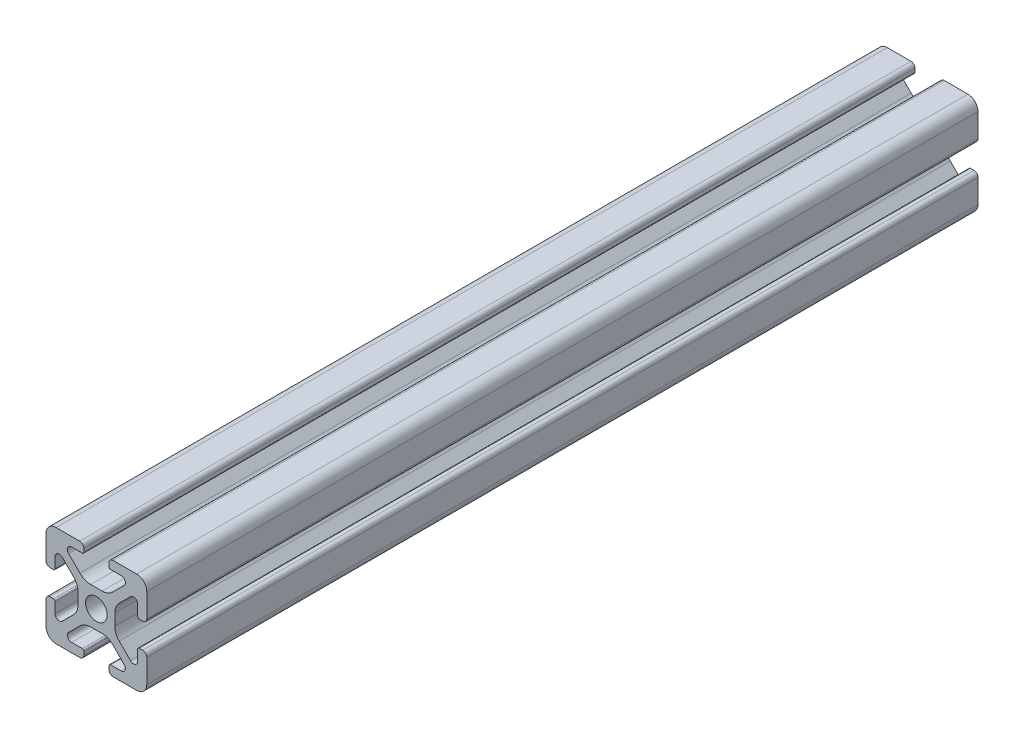
from build123d import *

# Parameters (mm, degrees)
ESQUISSE1_R        = 2.15
BOSS_EXTRU_1_DEPTH = 165


with BuildPart() as part:
    # Esquisse1 → Boss.-Extru.1 (new body)
    with BuildSketch(Plane(origin=(0, 0, 0), x_dir=(-1, 0, 0), z_dir=(0, 0, -1))):
        with BuildLine():
            Line((-12.499999997, 0.800000003), (-12.499999998, 1.500000003))
            ThreePointArc((-12.499999998, 1.500000003), (-12.587867964, 1.712132039), (-12.8, 1.800000005))
            Line((-12.8, 1.800000005), (-14.9175884, 1.800000005))
            ThreePointArc((-14.9175884, 1.800000005), (-15.686636444, 2.31386148), (-15.50619229, 3.2210155))
            Line((-15.50619229, 3.2210155), (-13.25588745, 5.47132034))
            ThreePointArc((-13.25588745, 5.47132034), (-12.282617404, 6.121638593), (-11.134567108, 6.349999996))
            Line((-11.134567108, 6.349999996), (-8.865432907, 6.349999996))
            ThreePointArc((-8.865432907, 6.349999996), (-7.717382611, 6.121638594), (-6.744112567, 5.471320341))
            Line((-6.744112567, 5.471320341), (-4.493807729, 3.221015503))
            ThreePointArc((-4.493807729, 3.221015503), (-4.313363575, 2.313861481), (-5.082411621, 1.800000005))
            Line((-5.082411621, 1.800000005), (-7.20000001, 1.800000005))
            ThreePointArc((-7.20000001, 1.800000005), (-7.412132045, 1.71213204), (-7.50000001, 1.500000005))
            Line((-7.50000001, 1.500000005), (-7.50000001, 0.8))
            ThreePointArc((-7.50000001, 0.8), (-7.265685435, 0.234314575), (-6.70000001, 0))
            Line((-6.70000001, 0), (-2, 0))
            ThreePointArc((-2, 0), (-0.585786438, 0.585786438), (0, 2))
            Line((0, 2), (0, 6.699999998))
            ThreePointArc((0, 6.699999998), (-0.234314576, 7.265685424), (-0.800000003, 7.5))
            Line((-0.800000003, 7.5), (-1.50000001, 7.5))
            ThreePointArc((-1.50000001, 7.5), (-1.712132046, 7.412132033), (-1.800000013, 7.199999997))
            Line((-1.800000013, 7.199999997), (-1.800000013, 5.082411603))
            ThreePointArc((-1.800000013, 5.082411603), (-2.313861487, 4.31336356), (-3.221015507, 4.493807713))
            Line((-3.221015507, 4.493807713), (-5.471320347, 6.744112553))
            ThreePointArc((-5.471320347, 6.744112553), (-6.1216386, 7.717382599), (-6.350000003, 8.865432896))
            Line((-6.350000003, 8.865432896), (-6.350000003, 11.134567102))
            ThreePointArc((-6.350000003, 11.134567102), (-6.121638601, 12.282617397), (-5.471320348, 13.255887442))
            Line((-5.471320348, 13.255887442), (-3.221015512, 15.506192278))
            ThreePointArc((-3.221015512, 15.506192278), (-2.313861489, 15.686636432), (-1.800000013, 14.917588386))
            Line((-1.800000013, 14.917588386), (-1.800000013, 12.799999998))
            ThreePointArc((-1.800000013, 12.799999998), (-1.712132047, 12.587867963), (-1.500000013, 12.499999997))
            Line((-1.500000013, 12.499999997), (-0.8, 12.499999997))
            ThreePointArc((-0.8, 12.499999997), (-0.234314575, 12.734314573), (0, 13.299999998))
            Line((0, 13.299999998), (0, 18))
            ThreePointArc((0, 18), (-0.585786438, 19.414213562), (-2, 20))
            Line((-2, 20), (-6.700000008, 20))
            ThreePointArc((-6.700000008, 20), (-7.265685435, 19.765685424), (-7.50000001, 19.199999998))
            Line((-7.50000001, 19.199999998), (-7.50000001, 18.500000005))
            ThreePointArc((-7.50000001, 18.500000005), (-7.412132044, 18.287867969), (-7.200000008, 18.200000003))
            Line((-7.200000008, 18.200000003), (-5.082411594, 18.200000003))
            ThreePointArc((-5.082411594, 18.200000003), (-4.313363546, 17.686138526), (-4.493807701, 16.778984501))
            Line((-4.493807701, 16.778984501), (-6.744112542, 14.528679659))
            ThreePointArc((-6.744112542, 14.528679659), (-7.717382588, 13.878361406), (-8.865432885, 13.650000003))
            Line((-8.865432885, 13.650000003), (-11.134567112, 13.650000003))
            ThreePointArc((-11.134567112, 13.650000003), (-12.282617407, 13.878361405), (-13.255887452, 14.528679658))
            Line((-13.255887452, 14.528679658), (-15.506192292, 16.778984498))
            ThreePointArc((-15.506192292, 16.778984498), (-15.686636447, 17.686138525), (-14.917588397, 18.200000002))
            Line((-14.917588397, 18.200000002), (-12.799999998, 18.200000003))
            ThreePointArc((-12.799999998, 18.200000003), (-12.587867963, 18.287867968), (-12.499999997, 18.500000002))
            Line((-12.499999997, 18.500000002), (-12.499999997, 19.2))
            ThreePointArc((-12.499999997, 19.2), (-12.734314573, 19.765685425), (-13.299999998, 20))
            Line((-13.299999998, 20), (-18, 20))
            ThreePointArc((-18, 20), (-19.414213562, 19.414213562), (-20, 18))
            Line((-20, 18), (-20, 13.3))
            ThreePointArc((-20, 13.3), (-19.765685424, 12.734314573), (-19.199999998, 12.499999997))
            Line((-19.199999998, 12.499999997), (-18.500000003, 12.499999997))
            ThreePointArc((-18.500000003, 12.499999997), (-18.287867967, 12.587867964), (-18.2, 12.8))
            Line((-18.2, 12.8), (-18.2, 14.91758839))
            ThreePointArc((-18.2, 14.91758839), (-17.686138526, 15.686636434), (-16.778984506, 15.50619228))
            Line((-16.778984506, 15.50619228), (-14.528679657, 13.255887431))
            ThreePointArc((-14.528679657, 13.255887431), (-13.878361403, 12.282617385), (-13.650000001, 11.134567088))
            Line((-13.650000001, 11.134567088), (-13.650000001, 8.865432886))
            ThreePointArc((-13.650000001, 8.865432886), (-13.878361403, 7.717382591), (-14.528679656, 6.744112546))
            Line((-14.528679656, 6.744112546), (-16.778984496, 4.493807706))
            ThreePointArc((-16.778984496, 4.493807706), (-17.686138522, 4.313363551), (-18.2, 5.0824116))
            Line((-18.2, 5.0824116), (-18.2, 7.2))
            ThreePointArc((-18.2, 7.2), (-18.287867966, 7.412132034), (-18.5, 7.5))
            Line((-18.5, 7.5), (-19.2, 7.5))
            ThreePointArc((-19.2, 7.5), (-19.765685425, 7.265685425), (-20, 6.7))
            Line((-20, 6.7), (-20, 2))
            ThreePointArc((-20, 2), (-19.414213562, 0.585786438), (-18, 0))
            Line((-18, 0), (-13.3, 0))
            ThreePointArc((-13.3, 0), (-12.734314573, 0.234314576), (-12.499999997, 0.800000003))
        make_face()
        with Locations(Location((-10, 10, 0), (0, 0, 180))):
            Circle(ESQUISSE1_R, mode=Mode.SUBTRACT)
    extrude(amount=-BOSS_EXTRU_1_DEPTH)


solid = part.part
